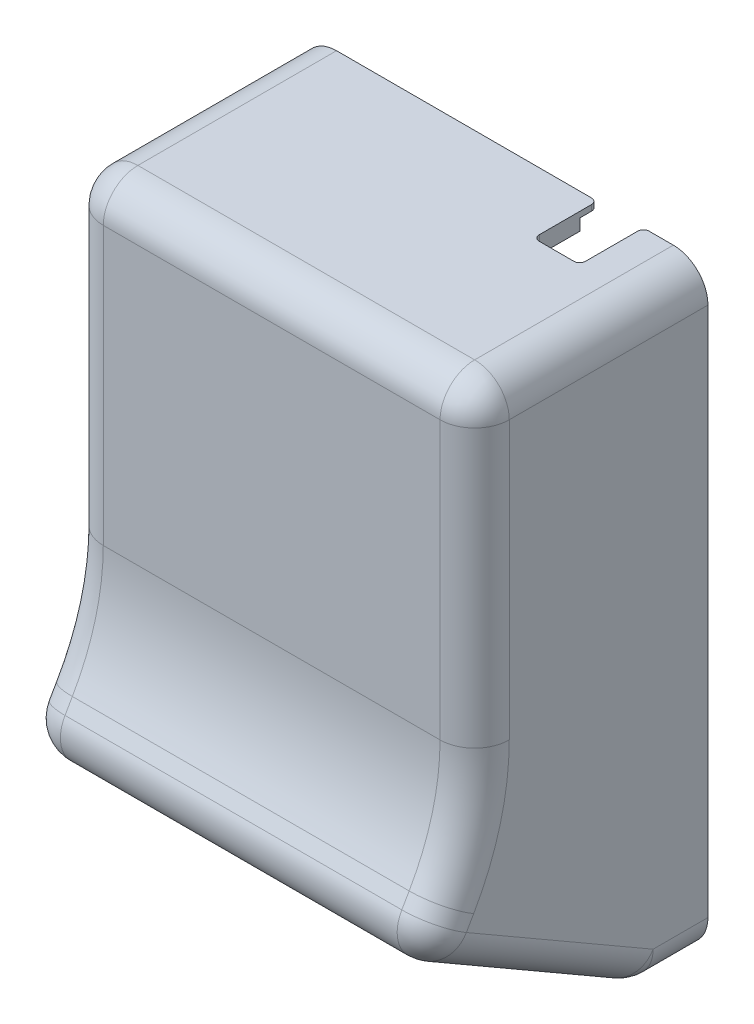
from build123d import *

# Parameters (mm, degrees)
SKETCH1_W           = 32.2
SKETCH1_H           = 21
BOSS_EXTRUDE2_DEPTH = 1.5
BOSS_EXTRUDE3_DEPTH = 1.5
BOSS_EXTRUDE4_DEPTH = 1.5
BOSS_EXTRUDE5_DEPTH = 35.2
SKETCH5_W           = 35.2
SKETCH5_H           = 5.556871517
BOSS_EXTRUDE6_DEPTH = 1.5
SKETCH6_W           = 35.2
SKETCH6_H           = 20.226133569
BOSS_EXTRUDE7_DEPTH = 1.5
FILLET3_R           = 20
FILLET_EXTERIOR_R   = 3
FILLET_INTERIOR_R   = 1.5
SKETCH7_W           = 4
SKETCH7_H           = 8.5
CUT_EXTRUDE1_DEPTH  = 1.5
FILLET4_R           = 0.5
CUT_EXTRUDE2_DEPTH  = 1.5
SCREW_BOSS1_REACH   = 41.636
SKETCH10_R          = 2.3
SKETCH10_R_2        = 0.8
SCREW_BOSS2_REACH   = 41.636
SKETCH11_R          = 2.3
SKETCH11_R_2        = 0.8


with BuildPart() as part:
    # Sketch1 → Boss-Extrude2 (new body)
    with BuildSketch(Plane(origin=(0, -25.251844214, 14.579159054), x_dir=(1, 0, 0), z_dir=(3.491481338843128e-15, -0.866025403784445, 0.4999999999999889))):
        with Locations((1.234580757, 10.21530973)):
            Rectangle(SKETCH1_W, SKETCH1_H)
        with BuildLine():
            Line((-0.015419243, 1.21530973), (2.484580757, 1.21530973))
            Line((2.484580757, 1.21530973), (2.484580757, 6.626786357))
            ThreePointArc((2.484580757, 6.626786357), (1.234580757, 14.01530973), (-0.015419243, 6.626786357))
            Line((-0.015419243, 6.626786357), (-0.015419243, 1.21530973))
        make_face(mode=Mode.SUBTRACT)
    extrude(amount=BOSS_EXTRUDE2_DEPTH)

    # Sketch2 → Boss-Extrude3 (add)
    with BuildSketch(Plane(origin=(17.334580757, 0, 0), x_dir=(0, 0, -1), z_dir=(1, 0, 0))):
        Polygon((-15.082610048, -26.693227454), (-9.525738531, -26.693227454), (-9.525738531, 25.295602697), (-28.2518721, 25.295602697), (-28.2518721, -7.503058425), (-33.269143528, -16.193227454), align=None)
    extrude(amount=BOSS_EXTRUDE3_DEPTH)

    # Sketch3 → Boss-Extrude4 (add)
    with BuildSketch(Plane.ZY.offset(14.865419243)):
        Polygon((28.2518721, 25.295602697), (28.2518721, -7.503058425), (33.269143528, -16.193227454), (15.082610048, -26.693227454), (9.525738531, -26.693227454), (9.525738531, 25.295602697), align=None)
    extrude(amount=BOSS_EXTRUDE4_DEPTH)

    # Sketch4 → Boss-Extrude5 (add)
    with BuildSketch(Plane(origin=(18.834580757, 0, 0), x_dir=(0, 0, -1), z_dir=(1, 0, 0))):
        Polygon((-28.2518721, -7.503058425), (-33.269143528, -16.193227454), (-34.568181634, -15.443227454), (-29.7518721, -7.101134637), (-29.7518721, 25.295602697), (-28.2518721, 25.295602697), align=None)
    extrude(amount=-BOSS_EXTRUDE5_DEPTH)

    # Sketch5 → Boss-Extrude6 (add)
    with BuildSketch(Plane.XZ.offset(26.693227454)):
        with Locations((1.234580757, 12.30417429)):
            Rectangle(SKETCH5_W, SKETCH5_H)
    extrude(amount=-BOSS_EXTRUDE6_DEPTH)

    # Sketch6 → Boss-Extrude7 (add)
    with BuildSketch(Plane(origin=(0, 25.295602697, 0), x_dir=(1, 0, 0), z_dir=(0, 1, 0))):
        with Locations((1.234580757, -19.638805316)):
            Rectangle(SKETCH6_W, SKETCH6_H)
    extrude(amount=-BOSS_EXTRUDE7_DEPTH)

    # Fillet3
    fillet3_edges = [part.edges().sort_by_distance(p)[0] for p in [
        (1.234580757, -7.101134637, 29.7518721),
    ]]
    fillet(fillet3_edges, radius=FILLET3_R)

    # Fillet-Exterior
    fillet_exterior_edges = [part.edges().sort_by_distance(p)[0] for p in [
        (-16.365419243, 11.776725954, 29.7518721),
        (18.834580757, -13.592689121, 33.499772829),
        (18.834580757, -6.91853169, 30.433355574),
        (-16.365419243, -6.91853169, 30.433355574),
        (1.234580757, -26.693227454, 15.082610048),
        (18.834580757, -21.068227454, 24.825395841),
        (18.834580757, -26.693227454, 12.30417429),
        (18.834580757, 25.295602697, 19.638805315),
        (-16.365419243, 25.295602697, 19.638805315),
        (-16.365419243, -26.693227454, 12.30417429),
        (-16.365419243, -21.068227454, 24.825395841),
        (1.234580757, -15.443227454, 34.568181634),
        (1.234580757, 25.295602697, 29.7518721),
        (18.834580757, 11.776725954, 29.7518721),
        (-16.365419243, -13.592689121, 33.499772829),
    ]]
    fillet(fillet_exterior_edges, radius=FILLET_EXTERIOR_R)

    # Fillet-Interior
    fillet_interior_edges = [part.edges().sort_by_distance(p)[0] for p in [
        (17.334580757, 8.146272136, 28.2518721),
        (17.334580757, 23.795602697, 18.888805315),
        (-14.865419243, 23.795602697, 18.888805315),
        (1.234580757, 23.795602697, 28.2518721),
        (17.334580757, -11.198623887, 30.385507814),
        (-14.865419243, -11.198623887, 30.385507814),
        (-14.865419243, 8.146272136, 28.2518721),
        (-14.865419243, -20.043708401, 23.599914894),
        (1.234580757, -14.894189349, 32.519143528),
        (1.234580757, -7.503058425, 28.2518721),
        (-14.865419243, -25.193227454, 12.103212395),
        (17.334580757, -20.043708401, 23.599914894),
        (1.234580757, -25.193227454, 14.68068626),
        (17.334580757, -25.193227454, 12.103212395),
    ]]
    fillet(fillet_interior_edges, radius=FILLET_INTERIOR_R)

    # Sketch7 → Cut-Extrude1 (cut)
    with BuildSketch(Plane(origin=(0, 25.295602697, 0), x_dir=(1, 0, 0), z_dir=(0, 1, 0))):
        with Locations((11.239580757, -10.8)):
            Rectangle(SKETCH7_W, SKETCH7_H)
    extrude(amount=-CUT_EXTRUDE1_DEPTH, mode=Mode.SUBTRACT)

    # Fillet4
    fillet4_edges = [part.edges().sort_by_distance(p)[0] for p in [
        (9.239580757, 24.545602697, 9.525738531),
        (9.239580757, 24.545602697, 15.05),
        (13.239580757, 24.545602697, 9.525738531),
        (13.239580757, 24.545602697, 15.05),
    ]]
    fillet(fillet4_edges, radius=FILLET4_R)

    # Sketch9 → Cut-Extrude2 (cut)
    with BuildSketch(Plane(origin=(0, 0, 9.525738531), x_dir=(-1, 0, 0), z_dir=(0, 0, -1))):
        with BuildLine():
            Line((13.365419243, -25.99226556), (-15.834580757, -25.99226556))
            add(Edge.make_bspline(
                [(-15.834580757, -25.99226556), (-16.142981162, -25.99226556), (-16.764416225, -25.886824157), (-17.587620167, -25.41563579), (-18.184470703, -24.656923007), (-18.334580757, -24.010728961), (-18.334580757, -23.693227454)],
                knots=[0, 0, 0, 0, 0.392699082, 0.785398163, 1.178097245, 1.570796327, 1.570796327, 1.570796327, 1.570796327], degree=3))
            Line((-18.334580757, -23.693227454), (-18.334580757, 22.295602697))
            ThreePointArc((-18.334580757, 22.295602697), (-17.60234771, 24.06336965), (-15.834580757, 24.795602697))
            Line((-15.834580757, 24.795602697), (13.365419243, 24.795602697))
            ThreePointArc((13.365419243, 24.795602697), (15.133186196, 24.06336965), (15.865419243, 22.295602697))
            Line((15.865419243, 22.295602697), (15.865419243, -23.693227454))
            add(Edge.make_bspline(
                [(15.865419243, -23.693227454), (15.865419243, -24.010728961), (15.715309189, -24.656923007), (15.118458653, -25.41563579), (14.295254711, -25.886824157), (13.673819649, -25.99226556), (13.365419243, -25.99226556)],
                knots=[1.570796327, 1.570796327, 1.570796327, 1.570796327, 1.963495408, 2.35619449, 2.748893572, 3.141592654, 3.141592654, 3.141592654, 3.141592654], degree=3))
        make_face()
        with BuildLine():
            Line((14.865419243, 22.295602697), (14.865419243, -23.693227454))
            add(Edge.make_bspline(
                [(13.365419243, -24.99226556), (14.865419243, -24.99226556), (14.865419243, -23.693227454)],
                knots=[1.570796327, 1.570796327, 1.570796327, 3.141592654, 3.141592654, 3.141592654], degree=2, weights=[1, 0.707106781, 1]))
            Line((13.365419243, -24.99226556), (-15.834580757, -24.99226556))
            add(Edge.make_bspline(
                [(-17.334580757, -23.693227454), (-17.334580757, -24.99226556), (-15.834580757, -24.99226556)],
                knots=[0, 0, 0, 1.570796327, 1.570796327, 1.570796327], degree=2, weights=[1, 0.707106781, 1]))
            Line((-17.334580757, -23.693227454), (-17.334580757, 22.295602697))
            ThreePointArc((-17.334580757, 22.295602697), (-16.895240929, 23.356262868), (-15.834580757, 23.795602697))
            Line((-15.834580757, 23.795602697), (13.365419243, 23.795602697))
            ThreePointArc((13.365419243, 23.795602697), (14.426079415, 23.356262868), (14.865419243, 22.295602697))
        make_face(mode=Mode.SUBTRACT)
    extrude(amount=-CUT_EXTRUDE2_DEPTH, mode=Mode.SUBTRACT)

    # Screw-Boss1: up to this face of the body (flat: up to its plane)
    screw_boss1_end = Plane(part.part.faces().sort_by_distance((1.234580757, 7.59723403, 28.2518721))[0])
    # Sketch10 → Screw-Boss1 (add, up to the picked face)
    with BuildSketch(Plane(origin=(0, 0, 11.025738531), x_dir=(-1, 0, 0), z_dir=(0, 0, -1)), mode=Mode.PRIVATE) as screw_boss1_sk1:
        with Locations((13.365419243, 22.295602697)):
            Circle(SKETCH10_R)
        with Locations((13.365419243, 22.295602697)):
            Circle(SKETCH10_R_2, mode=Mode.SUBTRACT)
    screw_boss1_tool1 = split(extrude(screw_boss1_sk1.sketch, amount=-SCREW_BOSS1_REACH, mode=Mode.PRIVATE), bisect_by=screw_boss1_end, keep=Keep.BOTH, mode=Mode.PRIVATE)
    add(screw_boss1_tool1.solids().sort_by(Axis((-11.130473, 22.295603, 11.025739), (0, 0, 1)))[0])

    # Screw-Boss2: up to this plane
    screw_boss2_end = Plane(origin=(0, -25.251844214, 14.579159054), z_dir=(3.5680069050429865e-15, -0.8660254037844453, 0.49999999999998884))
    # Sketch11 → Screw-Boss2 (add, up to the surface)
    with BuildSketch(Plane(origin=(0, 0, 11.025738531), x_dir=(-1, 0, 0), z_dir=(0, 0, -1)), mode=Mode.PRIVATE) as screw_boss2_sk1:
        with Locations((13.365419243, -23.693227454)):
            Circle(SKETCH11_R)
        with Locations((13.365419243, -23.693227454)):
            Circle(SKETCH11_R_2, mode=Mode.SUBTRACT)
    screw_boss2_tool1 = split(extrude(screw_boss2_sk1.sketch, amount=-SCREW_BOSS2_REACH, mode=Mode.PRIVATE), bisect_by=screw_boss2_end, keep=Keep.BOTH, mode=Mode.PRIVATE)
    add(screw_boss2_tool1.solids().sort_by_distance((-11.130473, -23.693227, 11.025739))[0])


solid = part.part
